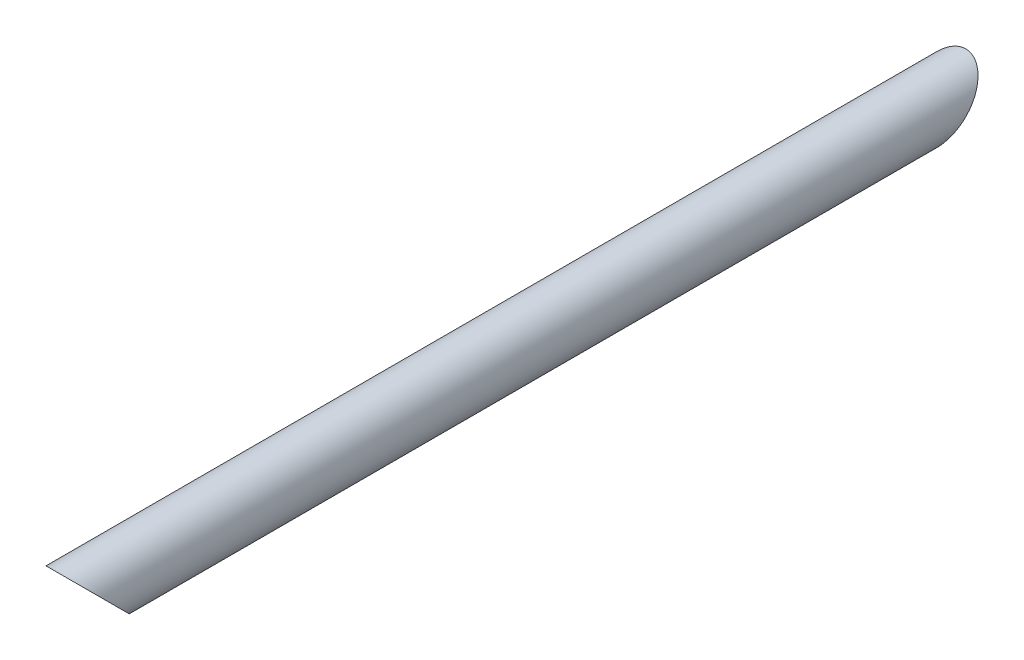
from build123d import *

# Parameters (mm, degrees)
SKETCH1_R               = 26.9875
BOSS_EXTRUDE1_DEPTH     = 831.85
CUT_EXTRUDE1_DEPTH      = 834.055558147
CUT_EXTRUDE1_DEPTH_BACK = 834.055558147


with BuildPart() as part:
    # Sketch1 → Boss-Extrude1 (new body)
    with BuildSketch(Plane.XY):
        with Locations(Location((-1.894266375, 7.261354436, 0), (0, 0, 180))):
            Circle(SKETCH1_R)
    extrude(amount=BOSS_EXTRUDE1_DEPTH)

    # Sketch2 → Cut-Extrude1 (cut, two sides: drawn at the far end of the back side and taken through both)
    with BuildSketch(Plane(origin=(0, 0, 0), x_dir=(0, 0, -1), z_dir=(1, 0, 0)).offset(-CUT_EXTRUDE1_DEPTH_BACK)):
        Polygon((-831.85, 34.248854436), (-777.875, -19.726145564), (-831.85, -19.726145564), align=None)
        Polygon((0, 34.248854436), (-53.975, -19.726145564), (0, -19.726145564), align=None)
    extrude(amount=CUT_EXTRUDE1_DEPTH + CUT_EXTRUDE1_DEPTH_BACK, mode=Mode.SUBTRACT)


solid = part.part
